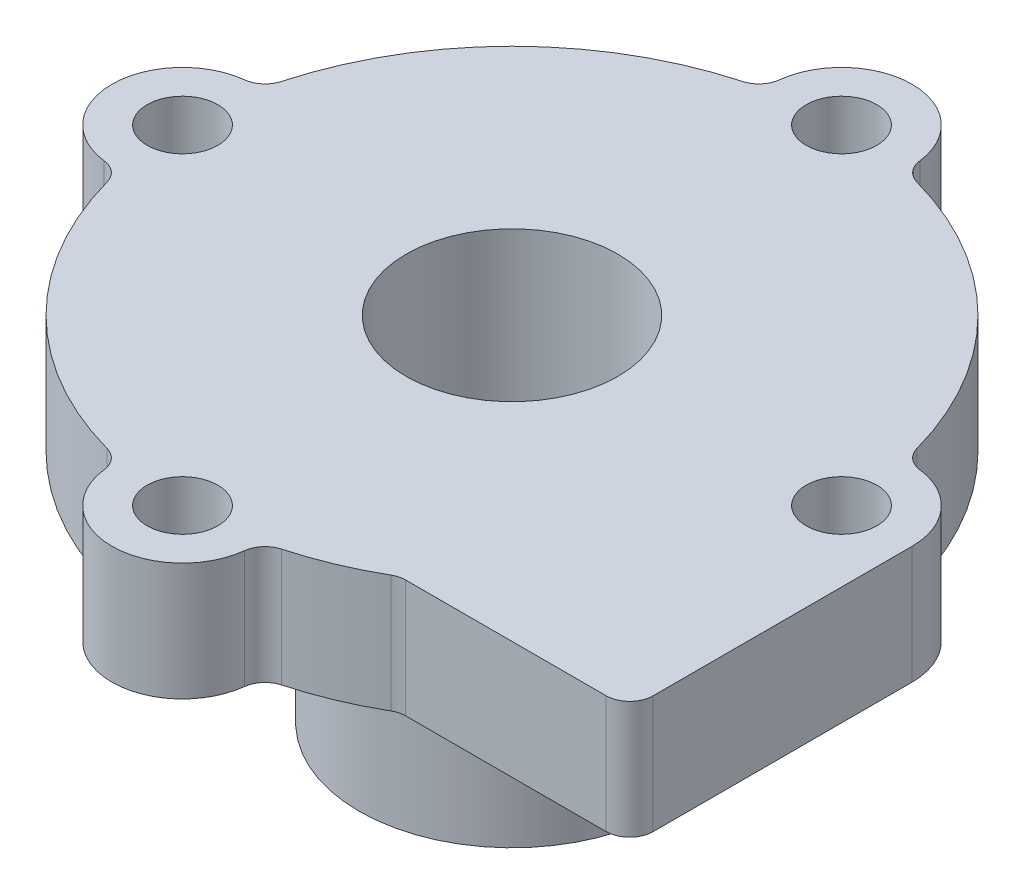
from build123d import *
from build123d.topology import SkipClean

# Parameters (mm, degrees)
SKETCH1_R           = 14
SKETCH1_R_2         = 4.5
BOSS_EXTRUDE1_DEPTH = 5
SKETCH3_R           = 3
BOSS_EXTRUDE2_DEPTH = 5
SKETCH4_R           = 1.5
CUT_EXTRUDE1_DEPTH  = 5
CIRPATTERN1_COUNT   = 4
BOSS_EXTRUDE3_DEPTH = 5
CIRPATTERN2_COUNT   = 4
BOSS_EXTRUDE4_START = 10
SKETCH6_R           = 6.5
SKETCH6_R_2         = 4.5
BOSS_EXTRUDE4_DEPTH = 10
FILLET2_R           = 1


with BuildPart() as part:
    # Sketch1 → Boss-Extrude1 (new body)
    with BuildSketch(Plane(origin=(0, 0, 0), x_dir=(1, 0, 0), z_dir=(0, 1, 0))):
        with Locations(Location((0, 0, 0), (0, 0, 270))):
            Circle(SKETCH1_R)
        with Locations(Location((0, 0, 0), (0, 0, 270))):
            Circle(SKETCH1_R_2, mode=Mode.SUBTRACT)
    extrude(amount=BOSS_EXTRUDE1_DEPTH)

    # Sketch3 → Boss-Extrude2 (add)
    with BuildSketch(Plane(origin=(0, 0, 0), x_dir=(1, 0, 0), z_dir=(0, 1, 0))):
        with Locations((0, 14)):
            Circle(SKETCH3_R)
    boss_extrude2 = extrude(amount=BOSS_EXTRUDE2_DEPTH)

    # Sketch4 → Cut-Extrude1 (cut)
    with BuildSketch(Plane(origin=(0, 5, 0), x_dir=(1, 0, 0), z_dir=(0, 1, 0))):
        with Locations(Location((0, 14, 0), (0, 0, 270))):
            Circle(SKETCH4_R)
    cut_extrude1 = extrude(amount=-CUT_EXTRUDE1_DEPTH, mode=Mode.SUBTRACT)

    # CirPattern1: Boss-Extrude2 ×4 about axis
    cirpattern1_axis = Axis((0, 0, 0), (0, 1, 0))
    for i in range(1, CIRPATTERN1_COUNT):
        add(boss_extrude2.rotate(cirpattern1_axis, i * 360 / CIRPATTERN1_COUNT))

    # Sketch5 → Boss-Extrude3 (add)
    with BuildSketch(Plane(origin=(0, 5, 0), x_dir=(1, 0, 0), z_dir=(0, 1, 0))):
        Polygon((0, -12), (17, -12), (17, 0), (10.271836612, 0), align=None)
    extrude(amount=-BOSS_EXTRUDE3_DEPTH)

    # CirPattern2: Cut-Extrude1 ×4 about axis
    cirpattern2_axis = Axis((0, 0, 0), (0, 1, 0))
    for i in range(1, CIRPATTERN2_COUNT):
        add(cut_extrude1.rotate(cirpattern2_axis, i * 360 / CIRPATTERN2_COUNT), mode=Mode.SUBTRACT)

    # Sketch6 → Boss-Extrude4 (add)
    with SkipClean():  # the faces are left unmerged after this step: merging them gives an invalid solid
        with BuildSketch(Plane.XZ.offset(BOSS_EXTRUDE4_START)):
            with Locations(Location((0, 0, 0), (0, 0, 90))):
                Circle(SKETCH6_R)
            with Locations(Location((0, 0, 0), (0, 0, 270))):
                Circle(SKETCH6_R_2, mode=Mode.SUBTRACT)
        extrude(amount=-BOSS_EXTRUDE4_DEPTH)

    # Fillet2
    fillet2_edges = [part.edges().sort_by_distance(p)[0] for p in [
        (-2.982730909, 2.5, -13.678571429),
        (2.982730909, 2.5, -13.678571429),
        (-13.678571429, 2.5, -2.982730909),
        (-13.678571429, 2.5, 2.982730909),
        (-2.982730909, 2.5, 13.678571429),
        (2.982730909, 2.5, 13.678571429),
        (13.678571429, 2.5, -2.982730909),
        (17, 2.5, 12),
        (7.211102551, 2.5, 12),
        (0, 0, -6.5),
    ]]
    fillet(fillet2_edges, radius=FILLET2_R)


solid = part.part
